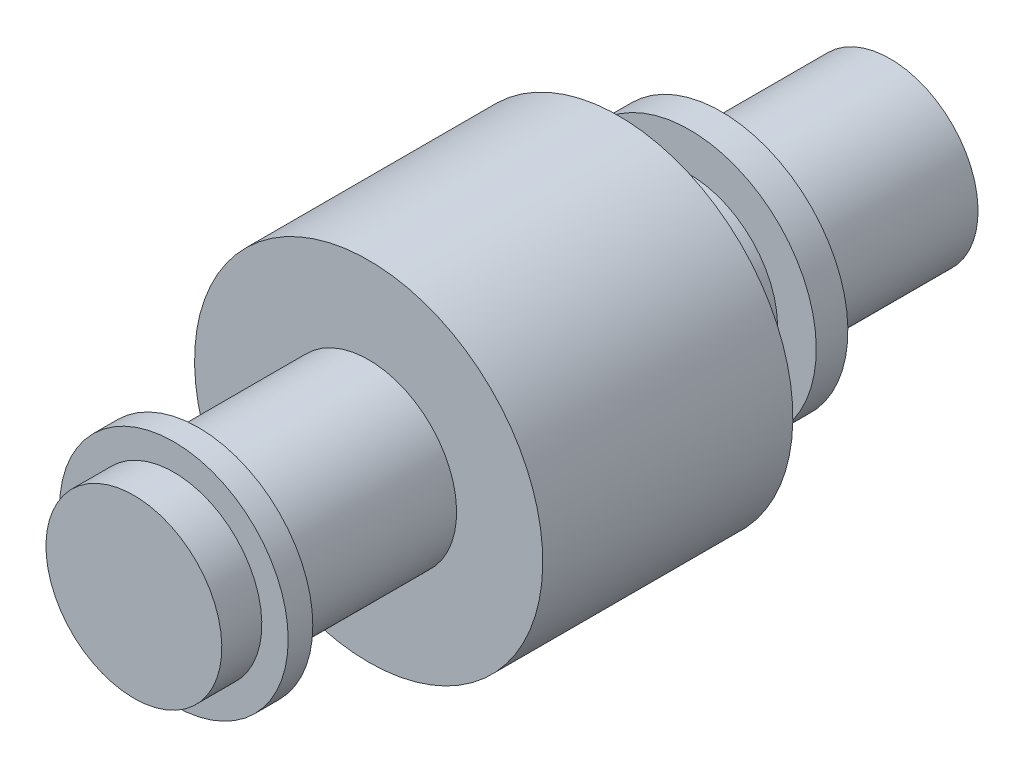
from build123d import *

# Parameters (mm, degrees)
SKETCH1_W          = 11.36904
SKETCH1_H          = 24.99995
SKETCH1_W_2        = 7.00024
SKETCH1_H_2        = 7.49935
SKETCH1_W_3        = 48.37938
SKETCH1_W_4        = 71.10476
SKETCH1_H_3        = 24.49957
SKETCH1_W_5        = 20.14982
SKETCH1_W_6        = 8.9916
SKETCH1_H_4        = 10.99947
SKETCH1_W_7        = 48.006
SKETCH2_R          = 3.3
CUT_EXTRUDE1_DEPTH = 9.525
CIRPATTERN2_COUNT  = 12


with BuildPart() as part:
    # Sketch1 → Revolve1 (revolve)
    with BuildSketch(Plane(origin=(0, 0, 0), x_dir=(0, 0, -1), z_dir=(1, 0, 0)), mode=Mode.PRIVATE) as revolve1_sk:
        with Locations((-101.8159, 12.499975)):
            Rectangle(SKETCH1_W, SKETCH1_H)
        with Locations((-92.63126, 12.499975)):
            Rectangle(SKETCH1_W_2, SKETCH1_H)
        with Locations((-92.63126, 28.749625)):
            Rectangle(SKETCH1_W_2, SKETCH1_H_2)
        with Locations((-64.94145, 12.499975)):
            Rectangle(SKETCH1_W_3, SKETCH1_H)
        with Locations((-5.19938, 12.499975)):
            Rectangle(SKETCH1_W_4, SKETCH1_H)
        with Locations((-5.19938, 37.249735)):
            Rectangle(SKETCH1_W_4, SKETCH1_H_3)
        with Locations((40.42791, 12.499975)):
            Rectangle(SKETCH1_W_5, SKETCH1_H)
        with Locations((54.99862, 12.499975)):
            Rectangle(SKETCH1_W_6, SKETCH1_H)
        with Locations((54.99862, 30.499685)):
            Rectangle(SKETCH1_W_6, SKETCH1_H_4)
        with Locations((83.49742, 12.499975)):
            Rectangle(SKETCH1_W_7, SKETCH1_H)
    revolve(revolve1_sk.sketch.rotate(Axis((0, 0, 107.50042), (0, 0, -1)), 180), axis=Axis((0, 0, 107.50042), (0, 0, -1)))

    # Sketch2 → Cut-Extrude1 (cut)
    with BuildSketch(Plane(origin=(0, 0, -30.353), x_dir=(-1, 0, 0), z_dir=(0, 0, -1))):
        with Locations(Location((0, 43.561, 0), (0, 0, 90))):
            Circle(SKETCH2_R)
    cut_extrude1 = extrude(amount=-CUT_EXTRUDE1_DEPTH, mode=Mode.SUBTRACT)

    # CirPattern2: Cut-Extrude1 ×12 about axis
    cirpattern2_axis = Axis((0, 0, 0), (0, 0, 1))
    for i in range(1, CIRPATTERN2_COUNT):
        add(cut_extrude1.rotate(cirpattern2_axis, i * 360 / CIRPATTERN2_COUNT), mode=Mode.SUBTRACT)


solid = part.part
